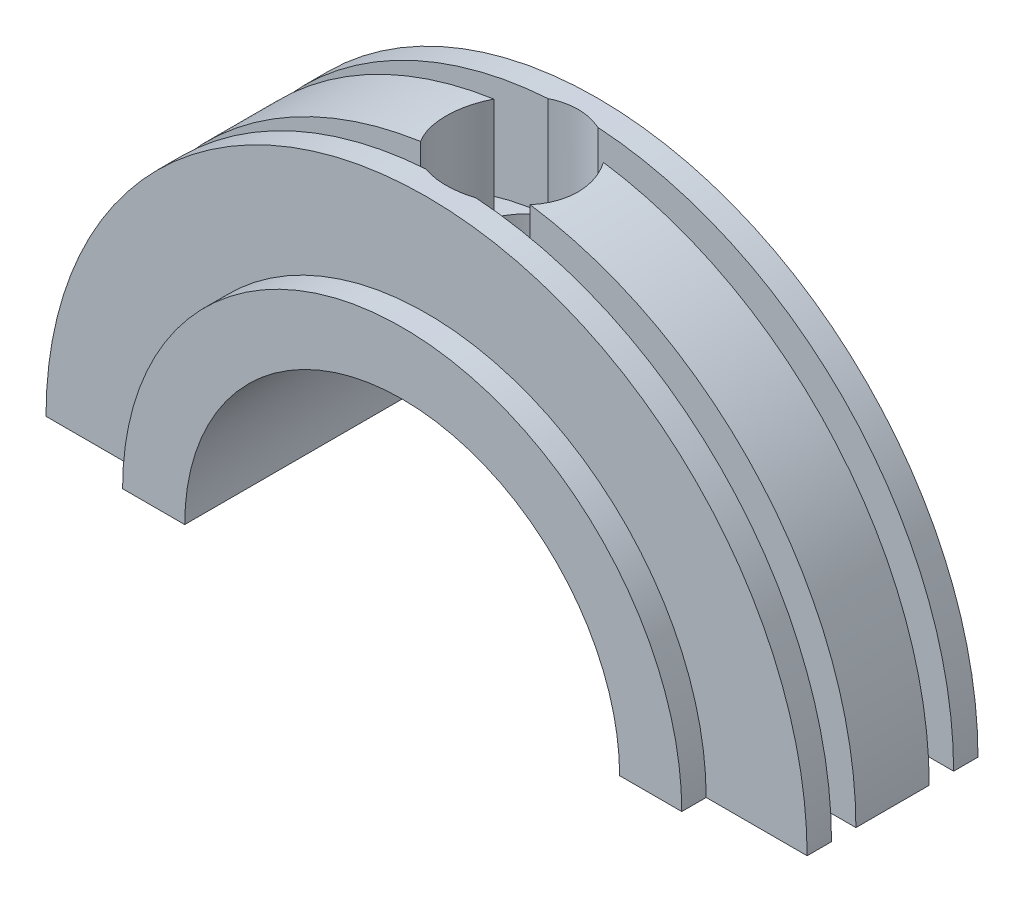
from build123d import *

# Parameters (mm, degrees)
CUT_EXTRUDE1_DEPTH      = 36.362195916
CUT_EXTRUDE1_DEPTH_BACK = 36.362195916
CUT_EXTRUDE2_DEPTH      = 36.362195916
CUT_EXTRUDE2_DEPTH_BACK = 36.362195916
SKETCH4_R               = 4.245


with BuildPart() as part:
    # Sketch1 → Revolve1 (revolve)
    with BuildSketch(Plane(origin=(0, 0, 0), x_dir=(1, 0, 0), z_dir=(0, 1, 0)), mode=Mode.PRIVATE) as revolve1_sk:
        Polygon((-14, -7.07), (-14, 7.07), (-18, 7.07), (-18, 5.5), (-24.5, 5.5), (-24.5, 3.93), (-18, 3.93), (-18, 2.36), (-24.5, 2.36), (-24.5, -2.36), (-18, -2.36), (-18, -3.93), (-24.5, -3.93), (-24.5, -5.5), (-18, -5.5), (-18, -7.07), align=None)
    revolve(revolve1_sk.sketch.rotate(Axis((0, 0, 0), (0, 0, -1)), 180), axis=Axis((0, 0, 0), (0, 0, -1)))

    # Sketch3 → Cut-Extrude1 (cut, two sides: drawn at the far end of the back side and taken through both)
    with BuildSketch(Plane.XY.offset(-CUT_EXTRUDE1_DEPTH_BACK)):
        with BuildLine():
            Line((-14, 0), (-24.5, 0))
            ThreePointArc((-24.5, 0), (0, -24.5), (24.5, 0))
            Line((24.5, 0), (14, 0))
            ThreePointArc((14, 0), (0, -14), (-14, 0))
        make_face()
    extrude(amount=CUT_EXTRUDE1_DEPTH + CUT_EXTRUDE1_DEPTH_BACK, mode=Mode.SUBTRACT)

    # Sketch4 → Cut-Extrude2 (cut, two sides: drawn at the far end of the back side and taken through both)
    with BuildSketch(Plane(origin=(0, 0, 0), x_dir=(1, 0, 0), z_dir=(0, 1, 0)).offset(-CUT_EXTRUDE2_DEPTH_BACK)):
        with Locations(Location((0, 0, 0), (0, 0, 90))):
            Circle(SKETCH4_R)
    extrude(amount=CUT_EXTRUDE2_DEPTH + CUT_EXTRUDE2_DEPTH_BACK, mode=Mode.SUBTRACT)

    # Sketch6 → Tap Drill for M2x0.4 Tap1 (revolve, cut)
    with BuildSketch(Plane(origin=(-21.25, 0, 0), x_dir=(0, 0, -1), z_dir=(1, 0, 0))):
        Polygon((0, 0), (0, 7.2), (1.1, 6.564914704), (1.1, 0), align=None)
    tap_drill_for_m2x0_4_tap1 = revolve(axis=Axis((-21.25, -6.35, 0), (0, 1, 0)), mode=Mode.SUBTRACT)

    # Mirror1: Tap Drill for M2x0.4 Tap1 across plane
    add(tap_drill_for_m2x0_4_tap1.mirror(Plane(origin=(0, 0, 0), x_dir=(0, 0, 1), z_dir=(1, 0, 0))), mode=Mode.SUBTRACT)


solid = part.part
